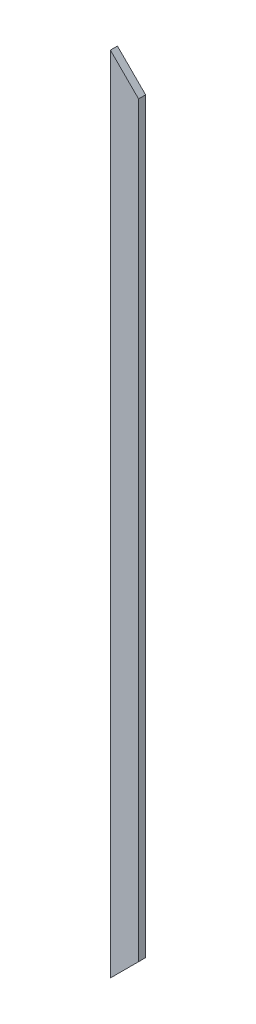
from build123d import *

# Parameters (mm, degrees)
BOSS_EXTRU_1_DEPTH = 5


with BuildPart() as part:
    # Esquisse1 → Boss.-Extru.1 (new body)
    with BuildSketch(Plane.XY):
        Polygon((0, 0), (10, 0), (10, -265), (0, -275), (-10, -285), (-10, 0), align=None)
    boss_extru_1 = extrude(amount=BOSS_EXTRU_1_DEPTH)

    # Symétrie1: Boss.-Extru.1 across plane
    add(boss_extru_1.mirror(Plane(origin=(0, 0, 5), x_dir=(0, 0, 1), z_dir=(0, -1, 0))))


solid = part.part
